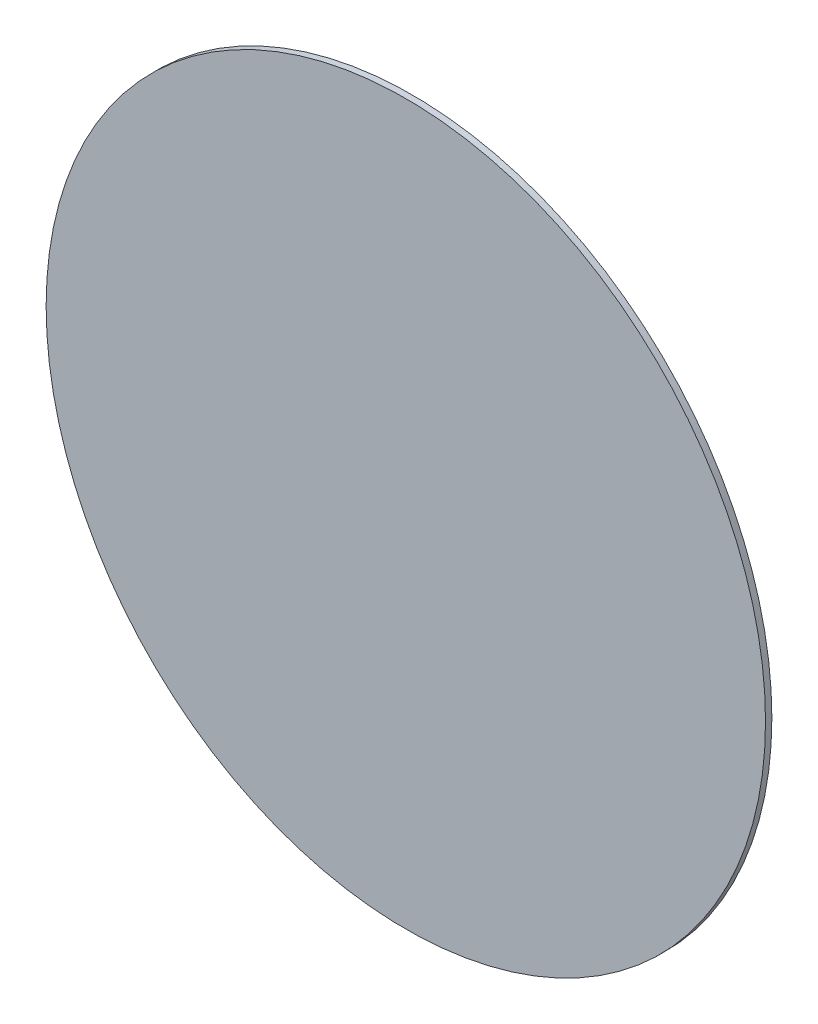
from build123d import *

# Parameters (mm, degrees)
SKETCH1_R           = 113.336684476
BOSS_EXTRUDE1_DEPTH = 2


with BuildPart() as part:
    # Sketch1 → Boss-Extrude1 (new body)
    with BuildSketch(Plane.XY):
        with Locations((-74.414862174, -31.38339944)):
            Circle(SKETCH1_R)
    extrude(amount=BOSS_EXTRUDE1_DEPTH)


solid = part.part
